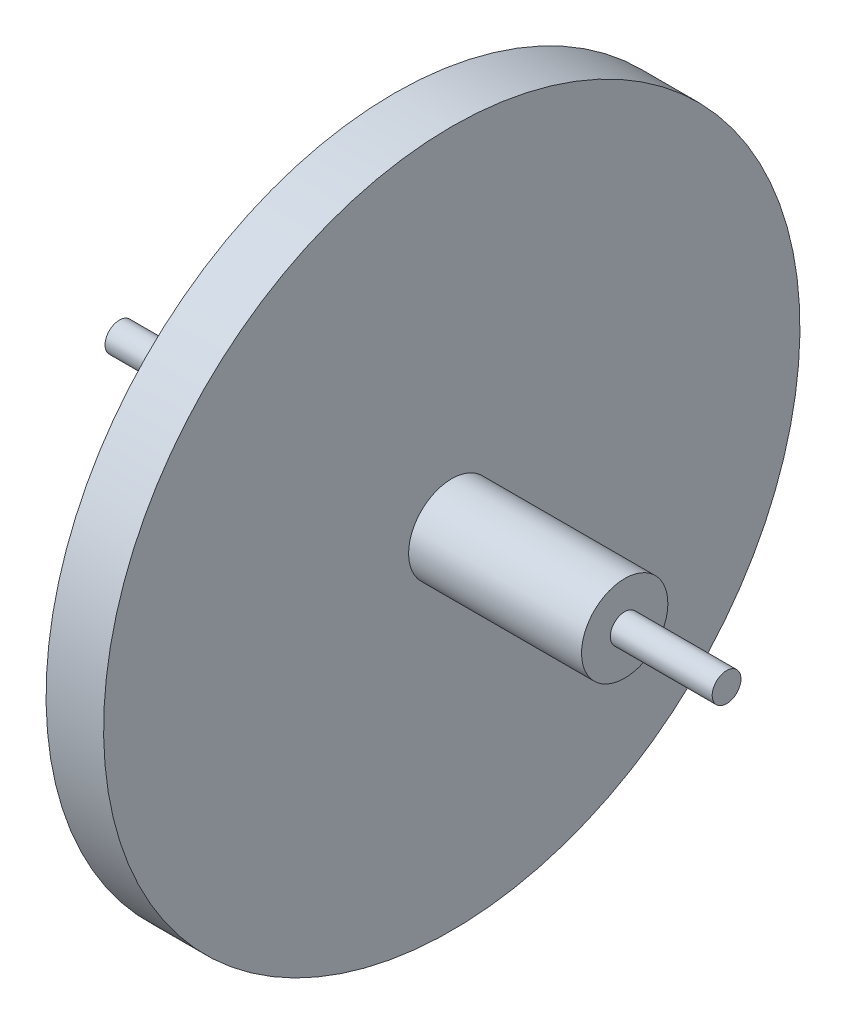
from build123d import *


with BuildPart() as part:
    # Sketch1 → Revolve1 (revolve)
    with BuildSketch(Plane.XY):
        Polygon((-105.5, 5), (-64.907285172, 5), (-64.907285172, 10), (-10, 10), (-10, 121), (10, 121), (10, 15), (70.092714828, 15), (70.092714828, 5), (105.5, 5), (105.5, 0), (-105.5, 0), align=None)
    revolve(axis=Axis((105.5, 0, 0), (-1, 0, 0)))


solid = part.part
